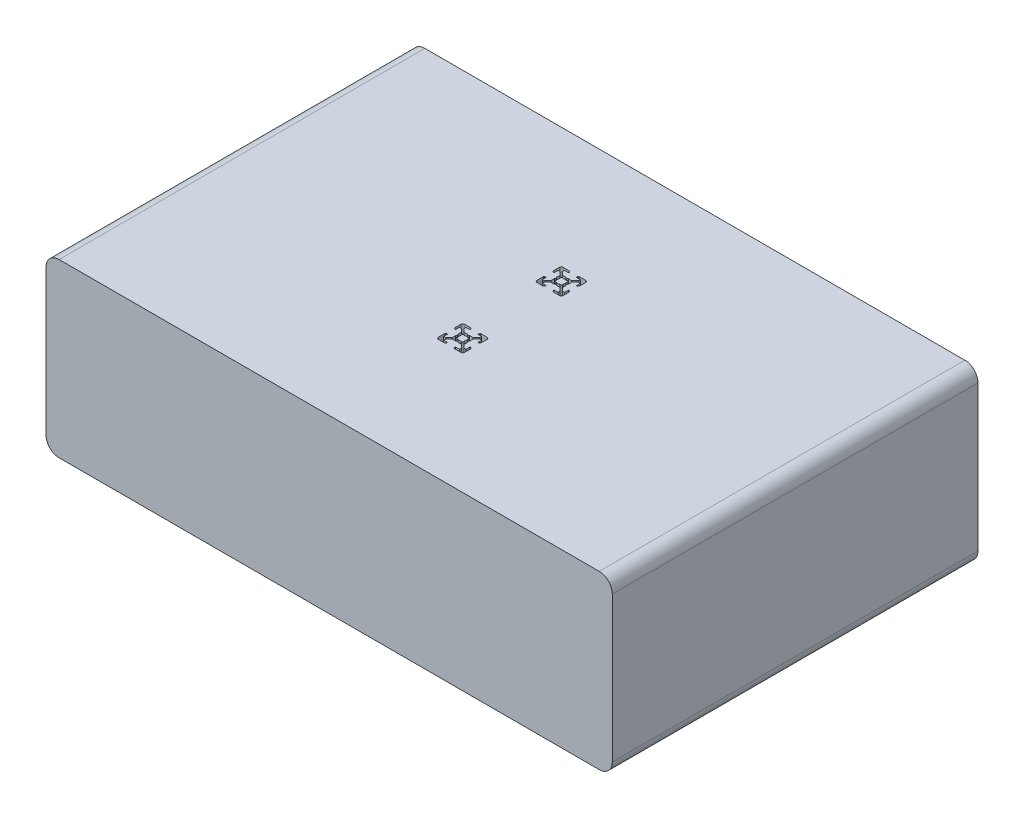
from build123d import *

# Parameters (mm, degrees)
ESQUISSE1_W             = 432
ESQUISSE1_H             = 279
BOSS_EXTRU_1_DEPTH      = 131
CONG_1_R                = 10
ENL_V_MAT_EXTRU_2_DEPTH = 100


with BuildPart() as part:
    # Esquisse1 → Boss.-Extru.1 (new body)
    with BuildSketch(Plane(origin=(0, 0, 0), x_dir=(1, 0, 0), z_dir=(0, 1, 0))):
        Rectangle(ESQUISSE1_W, ESQUISSE1_H)
    extrude(amount=BOSS_EXTRU_1_DEPTH)

    # Congé1
    cong_1_edges = [part.edges().sort_by_distance(p)[0] for p in [
        (-216, 131, 0),
        (216, 131, 0),
        (-216, 0, 0),
        (216, 0, 0),
    ]]
    fillet(cong_1_edges, radius=CONG_1_R)

    # Esquisse3 → Enlèv. mat.-Extru.2 (cut)
    # profile 1 of 2: a face of its own
    with BuildSketch(Plane(origin=(0, 131, 0), x_dir=(1, 0, 0), z_dir=(0, 1, 0))):
        with BuildLine():
            Line((-10, 34.1), (-10, 29.1))
            ThreePointArc((-10, 29.1), (-9.560660172, 28.039339828), (-8.5, 27.6))
            Line((-8.5, 27.6), (-3.5, 27.6))
            Line((-3.5, 27.6), (-3.5, 28.1))
            Line((-3.5, 28.1), (-3, 28.1))
            Line((-3, 28.1), (-3, 29.1))
            Line((-3, 29.1), (-6, 29.1))
            Line((-6, 29.1), (-6, 30.539339828))
            Line((-6, 30.539339828), (-3.439339828, 33.1))
            Line((-3.439339828, 33.1), (-0.866025404, 33.1))
            Line((-0.866025404, 33.1), (0, 33.6))
            Line((0, 33.6), (0.866025404, 33.1))
            Line((0.866025404, 33.1), (3.439339828, 33.1))
            Line((3.439339828, 33.1), (6, 30.539339828))
            Line((6, 30.539339828), (6, 29.1))
            Line((6, 29.1), (3, 29.1))
            Line((3, 29.1), (3, 28.1))
            Line((3, 28.1), (3.5, 28.1))
            Line((3.5, 28.1), (3.5, 27.6))
            Line((3.5, 27.6), (8.5, 27.6))
            ThreePointArc((8.5, 27.6), (9.560660172, 28.039339828), (10, 29.1))
            Line((10, 29.1), (10, 34.1))
            Line((10, 34.1), (9.5, 34.1))
            Line((9.5, 34.1), (9.5, 34.6))
            Line((9.5, 34.6), (8.5, 34.6))
            Line((8.5, 34.6), (8.5, 31.6))
            Line((8.5, 31.6), (7.060660172, 31.6))
            Line((7.060660172, 31.6), (4.5, 34.160660172))
            Line((4.5, 34.160660172), (4.5, 36.733974596))
            Line((4.5, 36.733974596), (4, 37.6))
            Line((4, 37.6), (4.5, 38.466025404))
            Line((4.5, 38.466025404), (4.5, 41.039339828))
            Line((4.5, 41.039339828), (7.060660172, 43.6))
            Line((7.060660172, 43.6), (8.5, 43.6))
            Line((8.5, 43.6), (8.5, 40.6))
            Line((8.5, 40.6), (9.5, 40.6))
            Line((9.5, 40.6), (9.5, 41.1))
            Line((9.5, 41.1), (10, 41.1))
            Line((10, 41.1), (10, 46.1))
            ThreePointArc((10, 46.1), (9.560660172, 47.160660172), (8.5, 47.6))
            Line((8.5, 47.6), (3.5, 47.6))
            Line((3.5, 47.6), (3.5, 47.1))
            Line((3.5, 47.1), (3, 47.1))
            Line((3, 47.1), (3, 46.1))
            Line((3, 46.1), (6, 46.1))
            Line((6, 46.1), (6, 44.660660172))
            Line((6, 44.660660172), (3.439339828, 42.1))
            Line((3.439339828, 42.1), (0.866025404, 42.1))
            Line((0.866025404, 42.1), (0, 41.6))
            Line((0, 41.6), (-0.866025404, 42.1))
            Line((-0.866025404, 42.1), (-3.439339828, 42.1))
            Line((-3.439339828, 42.1), (-6, 44.660660172))
            Line((-6, 44.660660172), (-6, 46.1))
            Line((-6, 46.1), (-3, 46.1))
            Line((-3, 46.1), (-3, 47.1))
            Line((-3, 47.1), (-3.5, 47.1))
            Line((-3.5, 47.1), (-3.5, 47.6))
            Line((-3.5, 47.6), (-8.5, 47.6))
            ThreePointArc((-8.5, 47.6), (-9.560660172, 47.160660172), (-10, 46.1))
            Line((-10, 46.1), (-10, 41.1))
            Line((-10, 41.1), (-9.5, 41.1))
            Line((-9.5, 41.1), (-9.5, 40.6))
            Line((-9.5, 40.6), (-8.5, 40.6))
            Line((-8.5, 40.6), (-8.5, 43.6))
            Line((-8.5, 43.6), (-7.060660172, 43.6))
            Line((-7.060660172, 43.6), (-4.5, 41.039339828))
            Line((-4.5, 41.039339828), (-4.5, 38.466025404))
            Line((-4.5, 38.466025404), (-4, 37.6))
            Line((-4, 37.6), (-4.5, 36.733974596))
            Line((-4.5, 36.733974596), (-4.5, 34.160660172))
            Line((-4.5, 34.160660172), (-7.060660172, 31.6))
            Line((-7.060660172, 31.6), (-8.5, 31.6))
            Line((-8.5, 31.6), (-8.5, 34.6))
            Line((-8.5, 34.6), (-9.5, 34.6))
            Line((-9.5, 34.6), (-9.5, 34.1))
            Line((-9.5, 34.1), (-10, 34.1))
        make_face()
        with BuildLine():
            Line((-3.000876196, 39.549592103), (-2.435900169, 38.876279893))
            ThreePointArc((-2.435900169, 38.876279893), (-2.749999439, 37.601756003), (-2.43752811, 36.326832018))
            Line((-2.43752811, 36.326832018), (-3.003181207, 35.652712908))
            Line((-3.003181207, 35.652712908), (-1.949592103, 34.599123804))
            Line((-1.949592103, 34.599123804), (-1.276279893, 35.164099831))
            ThreePointArc((-1.276279893, 35.164099831), (-0.001756003, 34.850000561), (1.273167982, 35.16247189))
            Line((1.273167982, 35.16247189), (1.947287092, 34.596818793))
            Line((1.947287092, 34.596818793), (3.000876196, 35.650407897))
            Line((3.000876196, 35.650407897), (2.435900169, 36.323720107))
            ThreePointArc((2.435900169, 36.323720107), (2.749999439, 37.598243997), (2.43752811, 38.873167982))
            Line((2.43752811, 38.873167982), (3.003181207, 39.547287092))
            Line((3.003181207, 39.547287092), (1.949592103, 40.600876196))
            Line((1.949592103, 40.600876196), (1.276279893, 40.035900169))
            ThreePointArc((1.276279893, 40.035900169), (0.001756003, 40.349999439), (-1.273167982, 40.03752811))
            Line((-1.273167982, 40.03752811), (-1.947287092, 40.603181207))
            Line((-1.947287092, 40.603181207), (-3.000876196, 39.549592103))
        make_face(mode=Mode.SUBTRACT)
    # profile 2 of 2: a face of its own
    with BuildSketch(Plane(origin=(0, 131, 0), x_dir=(1, 0, 0), z_dir=(0, 1, 0))):
        with BuildLine():
            Line((-10, -41.1), (-10, -46.1))
            ThreePointArc((-10, -46.1), (-9.560660172, -47.160660172), (-8.5, -47.6))
            Line((-8.5, -47.6), (-3.5, -47.6))
            Line((-3.5, -47.6), (-3.5, -47.1))
            Line((-3.5, -47.1), (-3, -47.1))
            Line((-3, -47.1), (-3, -46.1))
            Line((-3, -46.1), (-6, -46.1))
            Line((-6, -46.1), (-6, -44.660660172))
            Line((-6, -44.660660172), (-3.439339828, -42.1))
            Line((-3.439339828, -42.1), (-0.866025404, -42.1))
            Line((-0.866025404, -42.1), (0, -41.6))
            Line((0, -41.6), (0.866025404, -42.1))
            Line((0.866025404, -42.1), (3.439339828, -42.1))
            Line((3.439339828, -42.1), (6, -44.660660172))
            Line((6, -44.660660172), (6, -46.1))
            Line((6, -46.1), (3, -46.1))
            Line((3, -46.1), (3, -47.1))
            Line((3, -47.1), (3.5, -47.1))
            Line((3.5, -47.1), (3.5, -47.6))
            Line((3.5, -47.6), (8.5, -47.6))
            ThreePointArc((8.5, -47.6), (9.560660172, -47.160660172), (10, -46.1))
            Line((10, -46.1), (10, -41.1))
            Line((10, -41.1), (9.5, -41.1))
            Line((9.5, -41.1), (9.5, -40.6))
            Line((9.5, -40.6), (8.5, -40.6))
            Line((8.5, -40.6), (8.5, -43.6))
            Line((8.5, -43.6), (7.060660172, -43.6))
            Line((7.060660172, -43.6), (4.5, -41.039339828))
            Line((4.5, -41.039339828), (4.5, -38.466025404))
            Line((4.5, -38.466025404), (4, -37.6))
            Line((4, -37.6), (4.5, -36.733974596))
            Line((4.5, -36.733974596), (4.5, -34.160660172))
            Line((4.5, -34.160660172), (7.060660172, -31.6))
            Line((7.060660172, -31.6), (8.5, -31.6))
            Line((8.5, -31.6), (8.5, -34.6))
            Line((8.5, -34.6), (9.5, -34.6))
            Line((9.5, -34.6), (9.5, -34.1))
            Line((9.5, -34.1), (10, -34.1))
            Line((10, -34.1), (10, -29.1))
            ThreePointArc((10, -29.1), (9.560660172, -28.039339828), (8.5, -27.6))
            Line((8.5, -27.6), (3.5, -27.6))
            Line((3.5, -27.6), (3.5, -28.1))
            Line((3.5, -28.1), (3, -28.1))
            Line((3, -28.1), (3, -29.1))
            Line((3, -29.1), (6, -29.1))
            Line((6, -29.1), (6, -30.539339828))
            Line((6, -30.539339828), (3.439339828, -33.1))
            Line((3.439339828, -33.1), (0.866025404, -33.1))
            Line((0.866025404, -33.1), (0, -33.6))
            Line((0, -33.6), (-0.866025404, -33.1))
            Line((-0.866025404, -33.1), (-3.439339828, -33.1))
            Line((-3.439339828, -33.1), (-6, -30.539339828))
            Line((-6, -30.539339828), (-6, -29.1))
            Line((-6, -29.1), (-3, -29.1))
            Line((-3, -29.1), (-3, -28.1))
            Line((-3, -28.1), (-3.5, -28.1))
            Line((-3.5, -28.1), (-3.5, -27.6))
            Line((-3.5, -27.6), (-8.5, -27.6))
            ThreePointArc((-8.5, -27.6), (-9.560660172, -28.039339828), (-10, -29.1))
            Line((-10, -29.1), (-10, -34.1))
            Line((-10, -34.1), (-9.5, -34.1))
            Line((-9.5, -34.1), (-9.5, -34.6))
            Line((-9.5, -34.6), (-8.5, -34.6))
            Line((-8.5, -34.6), (-8.5, -31.6))
            Line((-8.5, -31.6), (-7.060660172, -31.6))
            Line((-7.060660172, -31.6), (-4.5, -34.160660172))
            Line((-4.5, -34.160660172), (-4.5, -36.733974596))
            Line((-4.5, -36.733974596), (-4, -37.6))
            Line((-4, -37.6), (-4.5, -38.466025404))
            Line((-4.5, -38.466025404), (-4.5, -41.039339828))
            Line((-4.5, -41.039339828), (-7.060660172, -43.6))
            Line((-7.060660172, -43.6), (-8.5, -43.6))
            Line((-8.5, -43.6), (-8.5, -40.6))
            Line((-8.5, -40.6), (-9.5, -40.6))
            Line((-9.5, -40.6), (-9.5, -41.1))
            Line((-9.5, -41.1), (-10, -41.1))
        make_face()
        with BuildLine():
            Line((-3.000876196, -35.650407897), (-2.435900169, -36.323720107))
            ThreePointArc((-2.435900169, -36.323720107), (-2.749999439, -37.598243997), (-2.43752811, -38.873167982))
            Line((-2.43752811, -38.873167982), (-3.003181207, -39.547287092))
            Line((-3.003181207, -39.547287092), (-1.949592103, -40.600876196))
            Line((-1.949592103, -40.600876196), (-1.276279893, -40.035900169))
            ThreePointArc((-1.276279893, -40.035900169), (-0.001756003, -40.349999439), (1.273167982, -40.03752811))
            Line((1.273167982, -40.03752811), (1.947287092, -40.603181207))
            Line((1.947287092, -40.603181207), (3.000876196, -39.549592103))
            Line((3.000876196, -39.549592103), (2.435900169, -38.876279893))
            ThreePointArc((2.435900169, -38.876279893), (2.749999439, -37.601756003), (2.43752811, -36.326832018))
            Line((2.43752811, -36.326832018), (3.003181207, -35.652712908))
            Line((3.003181207, -35.652712908), (1.949592103, -34.599123804))
            Line((1.949592103, -34.599123804), (1.276279893, -35.164099831))
            ThreePointArc((1.276279893, -35.164099831), (0.001756003, -34.850000561), (-1.273167982, -35.16247189))
            Line((-1.273167982, -35.16247189), (-1.947287092, -34.596818793))
            Line((-1.947287092, -34.596818793), (-3.000876196, -35.650407897))
        make_face(mode=Mode.SUBTRACT)
    extrude(amount=-ENL_V_MAT_EXTRU_2_DEPTH, mode=Mode.SUBTRACT)


solid = part.part
